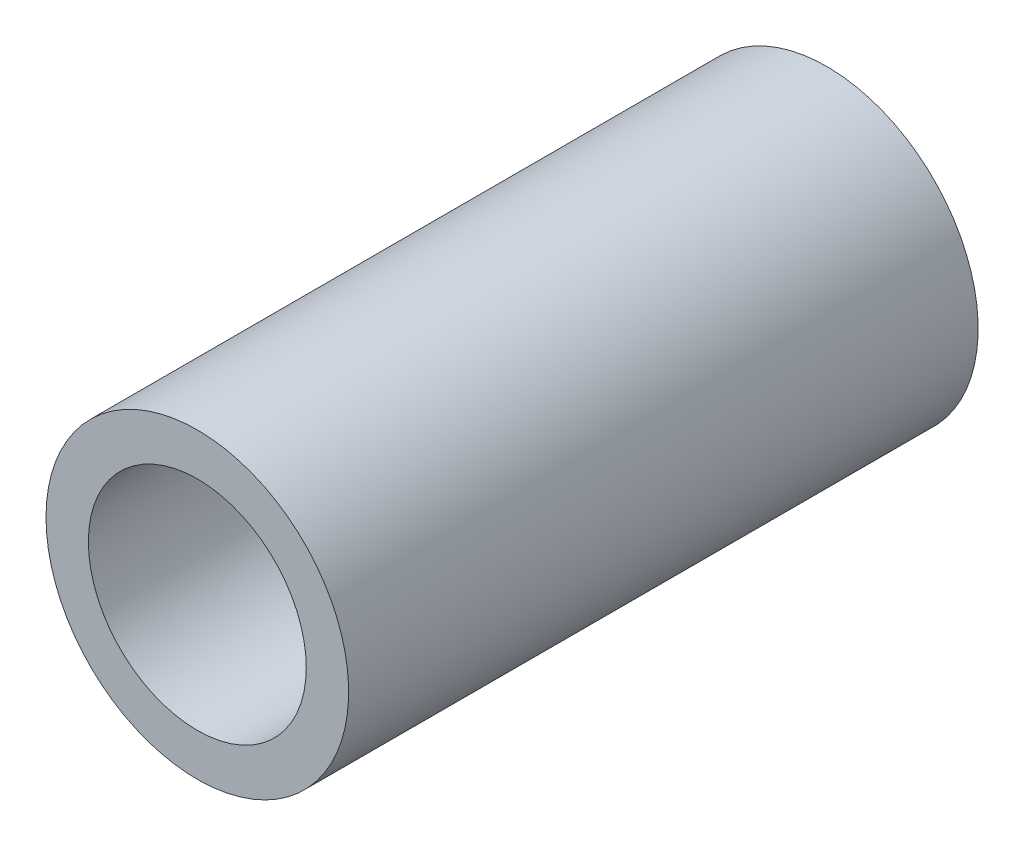
from build123d import *

# Parameters (mm, degrees)
SCHIZZO1_R                   = 12.5
SCHIZZO1_R_2                 = 9
ESTRUSIONE_ESTRUSIONE1_DEPTH = 26


with BuildPart() as part:
    # Schizzo1 → Estrusione-Estrusione1 (new, symmetric)
    with BuildSketch(Plane.XY):
        with Locations(Location((0, 0, 0), (0, 0, 180))):
            Circle(SCHIZZO1_R)
        with Locations(Location((0, 0, 0), (0, 0, 180))):
            Circle(SCHIZZO1_R_2, mode=Mode.SUBTRACT)
    extrude(amount=ESTRUSIONE_ESTRUSIONE1_DEPTH, both=True)


solid = part.part
